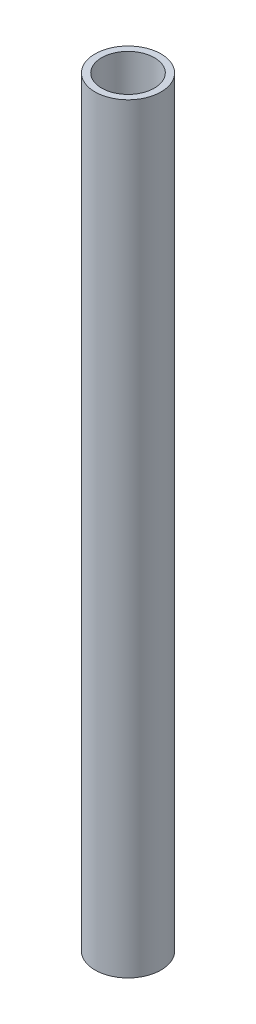
from build123d import *

# Parameters (mm, degrees)
SKETCH_1_R      = 5
SKETCH_1_R_2    = 4
EXTRUDE_1_DEPTH = 115.3


with BuildPart() as part:
    # Эскиз1 → Бобышка-Вытянуть1 (new body)
    with BuildSketch(Plane(origin=(0, 0, 0), x_dir=(1, 0, 0), z_dir=(0, 1, 0))):
        with Locations(Location((0, 0, 0), (0, 0, 90))):
            Circle(SKETCH_1_R)
        with Locations(Location((0, 0, 0), (0, 0, 90))):
            Circle(SKETCH_1_R_2, mode=Mode.SUBTRACT)
    extrude(amount=EXTRUDE_1_DEPTH)


solid = part.part
